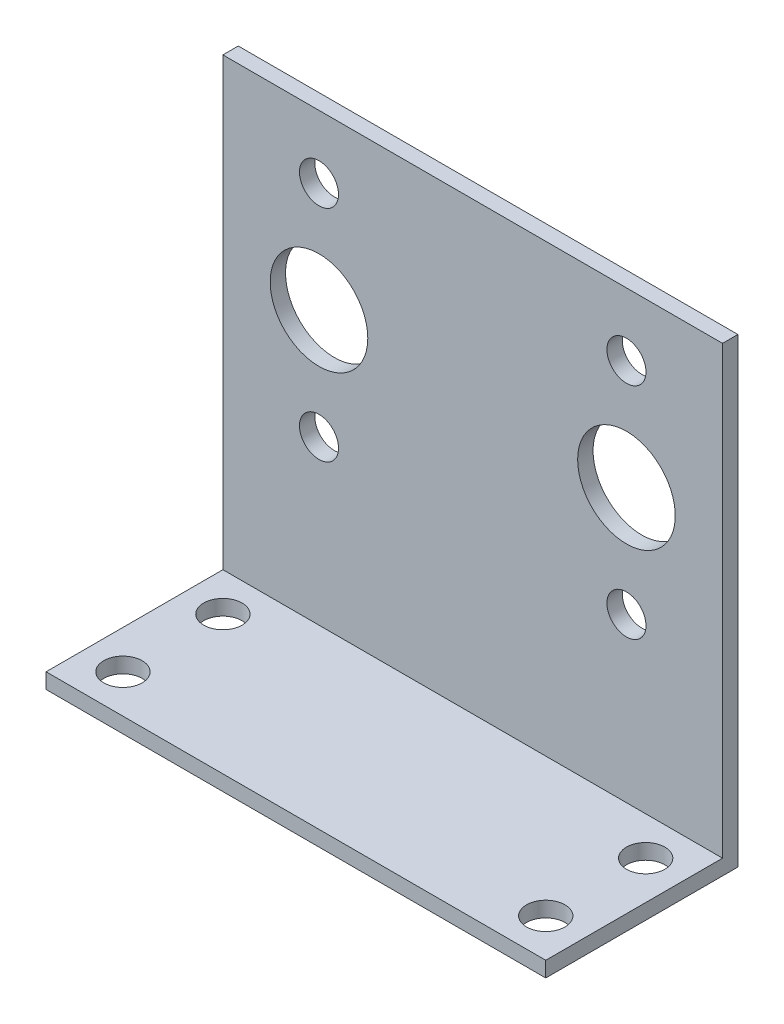
from build123d import *

# Parameters (mm, degrees)
SKETCH1_W           = 130
SKETCH1_H           = 120
BOSS_EXTRUDE1_DEPTH = 4
SKETCH2_R           = 12.7
SKETCH2_R_2         = 5.08
CUT_EXTRUDE1_DEPTH  = 89.549421229
BOSS_EXTRUDE2_START = -4
SKETCH3_W           = 130
SKETCH3_H           = 4
BOSS_EXTRUDE2_DEPTH = 50
SKETCH5_R           = 5
CUT_EXTRUDE2_DEPTH  = 143.059846544


with BuildPart() as part:
    # Sketch1 → Boss-Extrude1 (new body)
    with BuildSketch(Plane.XY):
        Rectangle(SKETCH1_W, SKETCH1_H)
    extrude(amount=BOSS_EXTRUDE1_DEPTH)

    # Sketch2 → Cut-Extrude1 (cut, through all)
    with BuildSketch(Plane.XY.offset(4)):
        with Locations((-40, 15)):
            Circle(SKETCH2_R)
        with Locations((-40, 43.575)):
            Circle(SKETCH2_R_2)
        with Locations(Location((-40, -13.575, 0), (0, 0, 180))):
            Circle(SKETCH2_R_2)
        with Locations((40, -13.575)):
            Circle(SKETCH2_R_2)
        with Locations(Location((40, 15, 0), (0, 0, 180))):
            Circle(SKETCH2_R)
        with Locations(Location((40, 43.575, 0), (0, 0, 180))):
            Circle(SKETCH2_R_2)
    extrude(amount=-CUT_EXTRUDE1_DEPTH, mode=Mode.SUBTRACT)

    # Sketch3 → Boss-Extrude2 (add)
    with BuildSketch(Plane.XY.offset(4).offset(BOSS_EXTRUDE2_START)):
        with Locations((0, -58)):
            Rectangle(SKETCH3_W, SKETCH3_H)
    extrude(amount=BOSS_EXTRUDE2_DEPTH)

    # Sketch5 → Cut-Extrude2 (cut, through all)
    with BuildSketch(Plane(origin=(0, -56, 0), x_dir=(1, 0, 0), z_dir=(0, 1, 0))):
        with Locations(Location((-55, -14, 0), (0, 0, 270))):
            Circle(SKETCH5_R)
        with Locations(Location((-55, -40, 0), (0, 0, 270))):
            Circle(SKETCH5_R)
    cut_extrude2 = extrude(amount=-CUT_EXTRUDE2_DEPTH, mode=Mode.SUBTRACT)

    # Mirror1: Cut-Extrude2 across plane
    add(cut_extrude2.mirror(Plane(origin=(0, 0, 0), x_dir=(0, 0, 1), z_dir=(1, 0, 0))), mode=Mode.SUBTRACT)


solid = part.part
